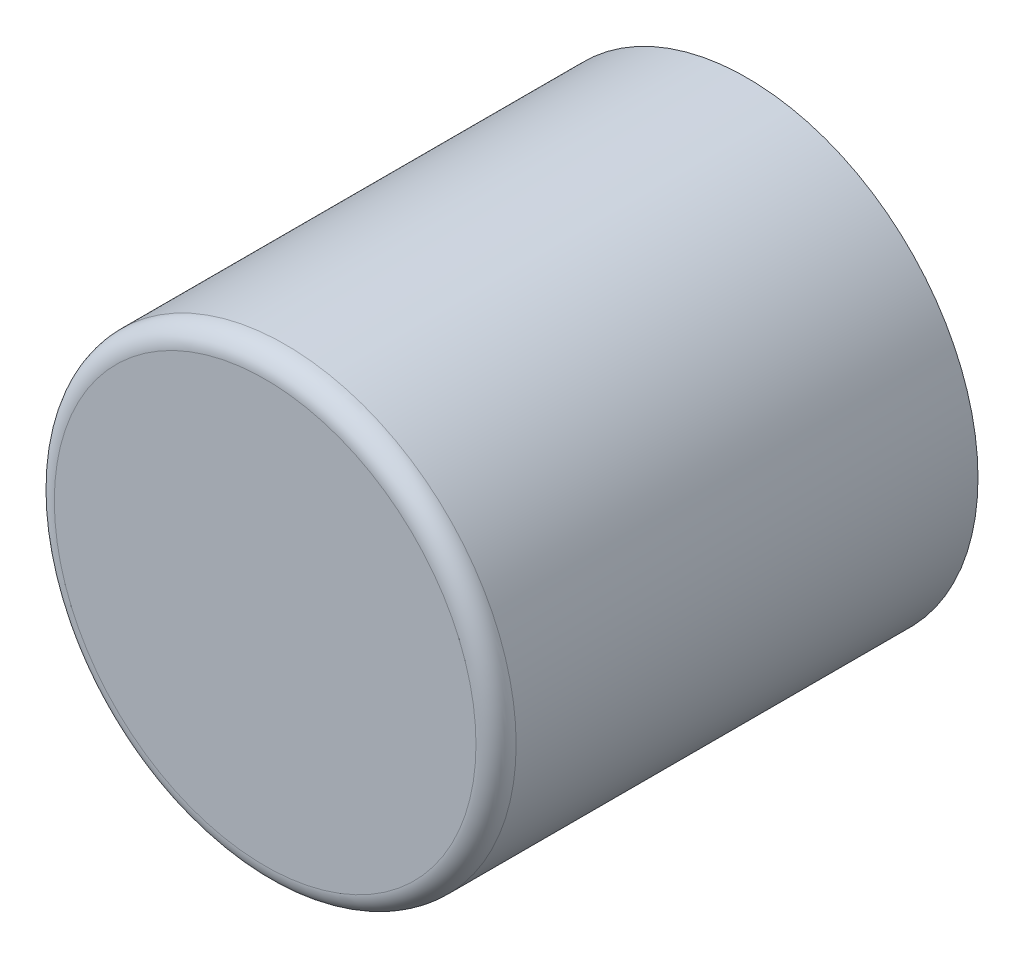
from build123d import *

# Parameters (mm, degrees)
SKETCH_1_R          = 23
EXTRUDE_1_DEPTH     = 48
SKETCH_2_R          = 19
CUT_EXTRUDE_1_DEPTH = 44
FILLET_1_R          = 2


with BuildPart() as part:
    # ｽｹｯﾁ1 → ﾎﾞｽ - 押し出し1 (new body)
    with BuildSketch(Plane.XY):
        Circle(SKETCH_1_R)
    extrude(amount=EXTRUDE_1_DEPTH)

    # ｽｹｯﾁ2 → ｶｯﾄ - 押し出し1 (cut)
    with BuildSketch(Plane(origin=(0, 0, 0), x_dir=(-1, 0, 0), z_dir=(0, 0, -1))):
        Circle(SKETCH_2_R)
    extrude(amount=-CUT_EXTRUDE_1_DEPTH, mode=Mode.SUBTRACT)

    # ﾌｨﾚｯﾄ1
    fillet_1_edges = [part.edges().sort_by_distance(p)[0] for p in [
        (-23, 0, 48),
    ]]
    fillet(fillet_1_edges, radius=FILLET_1_R)


solid = part.part
